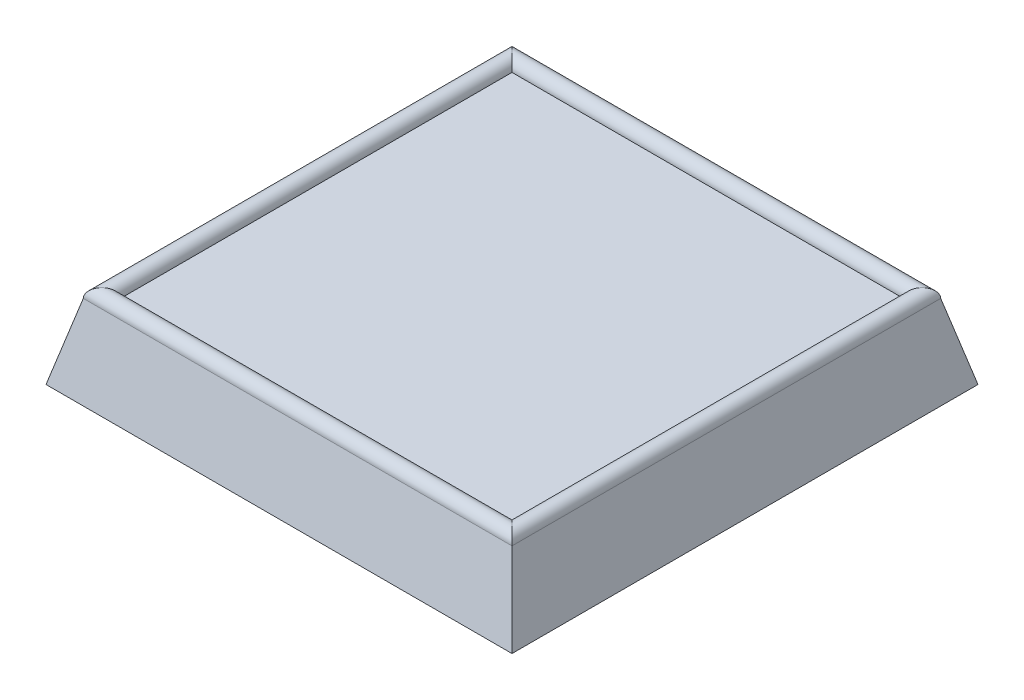
from build123d import *


with BuildPart() as part:
    # 草图2 → 放样1 section 0
    with BuildSketch(Plane(origin=(0, 0, 0), x_dir=(1, 0, 0), z_dir=(0, 1, 0))):
        with BuildLine():
            Line((-115, -115), (-115, 115))
            Line((-115, 115), (115, 115))
            Line((115, 115), (115, -115))
            Line((115, -115), (-115, -115))
        make_face()
    # 草图3 → 放样1 section 1
    with BuildSketch(Plane(origin=(0, -40, 0), x_dir=(1, 0, 0), z_dir=(0, 1, 0))):
        with BuildLine():
            Line((125, -125), (125, 125))
            Line((125, 125), (-125, 125))
            Line((-125, 125), (-125, -125))
            Line((-125, -125), (125, -125))
        make_face()
    loft()

    # 扫描1: sweep along a path in 草图2<2>
    with BuildLine(Plane(origin=(0, 0, 0), x_dir=(1, 0, 0), z_dir=(0, 1, 0))) as sweep_1_path:
        Line((-115, -115), (-115, 115))
        Line((-115, 115), (115, 115))
        Line((115, 115), (115, -115))
        Line((115, -115), (-115, -115))
    # 草图4 → 扫描1 (sweep)
    with BuildSketch(Plane(origin=(0, 0, 115), x_dir=(-1, 0, 0), z_dir=(0, 0, -1))):
        with BuildLine():
            Line((-115, 0), (-105, 0))
            ThreePointArc((-105, 0), (-110, 5), (-115, 0))
        make_face()
    sweep(path=sweep_1_path.line, transition=Transition.RIGHT)


solid = part.part
